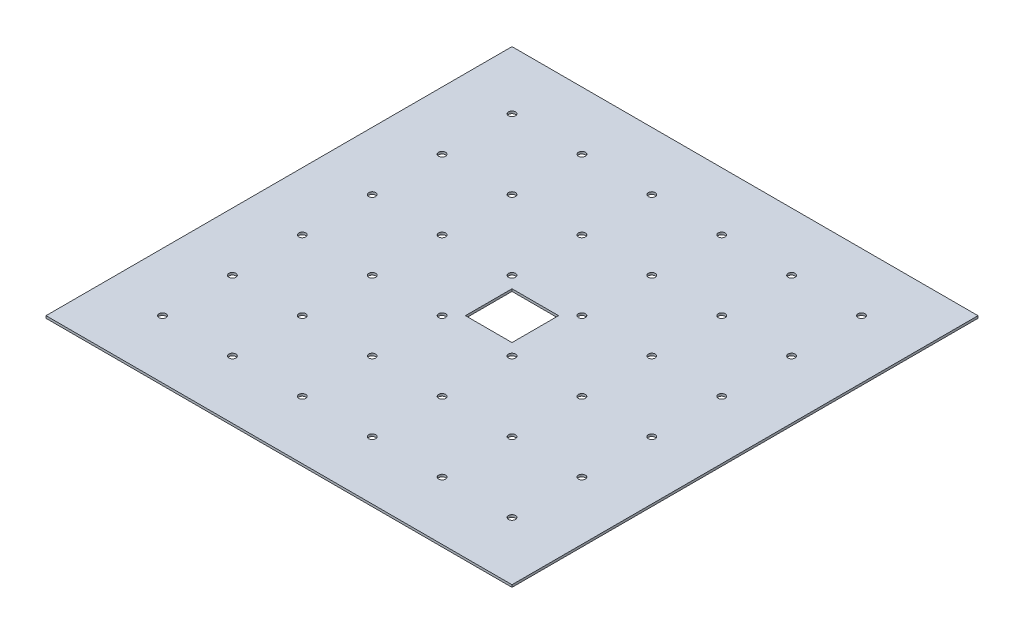
from build123d import *

# Parameters (mm, degrees)
SKETCH1_W           = 400
SKETCH1_H           = 400
BOSS_EXTRUDE1_DEPTH = 2
SKETCH2_R           = 3
CUT_EXTRUDE1_DEPTH  = 283.849783454
SKETCH3_W           = 40
SKETCH3_H           = 40
CUT_EXTRUDE2_DEPTH  = 283.849783454


with BuildPart() as part:
    # Sketch1 → Boss-Extrude1 (new body)
    with BuildSketch(Plane(origin=(0, 0, 0), x_dir=(1, 0, 0), z_dir=(0, 1, 0))):
        Rectangle(SKETCH1_W, SKETCH1_H)
    extrude(amount=BOSS_EXTRUDE1_DEPTH)

    # Sketch2 → Cut-Extrude1 (cut, through all)
    with BuildSketch(Plane(origin=(0, 2, 0), x_dir=(1, 0, 0), z_dir=(0, 1, 0))):
        with Locations(Location((-150, 150, 0), (0, 0, 270))):
            Circle(SKETCH2_R)
        with Locations(Location((-90, 150, 0), (0, 0, 270))):
            Circle(SKETCH2_R)
        with Locations(Location((-30, 150, 0), (0, 0, 270))):
            Circle(SKETCH2_R)
        with Locations(Location((30, 150, 0), (0, 0, 270))):
            Circle(SKETCH2_R)
        with Locations(Location((90, 150, 0), (0, 0, 270))):
            Circle(SKETCH2_R)
        with Locations(Location((150, 150, 0), (0, 0, 270))):
            Circle(SKETCH2_R)
        with Locations(Location((-90, 90, 0), (0, 0, 270))):
            Circle(SKETCH2_R)
        with Locations(Location((-30, 90, 0), (0, 0, 270))):
            Circle(SKETCH2_R)
        with Locations(Location((30, 90, 0), (0, 0, 270))):
            Circle(SKETCH2_R)
        with Locations(Location((90, 90, 0), (0, 0, 270))):
            Circle(SKETCH2_R)
        with Locations(Location((150, 90, 0), (0, 0, 270))):
            Circle(SKETCH2_R)
        with Locations(Location((-90, 30, 0), (0, 0, 270))):
            Circle(SKETCH2_R)
        with Locations(Location((-30, 30, 0), (0, 0, 270))):
            Circle(SKETCH2_R)
        with Locations(Location((30, 30, 0), (0, 0, 270))):
            Circle(SKETCH2_R)
        with Locations(Location((90, 30, 0), (0, 0, 270))):
            Circle(SKETCH2_R)
        with Locations(Location((150, 30, 0), (0, 0, 270))):
            Circle(SKETCH2_R)
        with Locations(Location((-90, -30, 0), (0, 0, 270))):
            Circle(SKETCH2_R)
        with Locations(Location((-30, -30, 0), (0, 0, 270))):
            Circle(SKETCH2_R)
        with Locations(Location((30, -30, 0), (0, 0, 270))):
            Circle(SKETCH2_R)
        with Locations(Location((90, -30, 0), (0, 0, 270))):
            Circle(SKETCH2_R)
        with Locations(Location((150, -30, 0), (0, 0, 270))):
            Circle(SKETCH2_R)
        with Locations(Location((-90, -90, 0), (0, 0, 270))):
            Circle(SKETCH2_R)
        with Locations(Location((-30, -90, 0), (0, 0, 270))):
            Circle(SKETCH2_R)
        with Locations(Location((30, -90, 0), (0, 0, 270))):
            Circle(SKETCH2_R)
        with Locations(Location((90, -90, 0), (0, 0, 270))):
            Circle(SKETCH2_R)
        with Locations(Location((150, -90, 0), (0, 0, 270))):
            Circle(SKETCH2_R)
        with Locations(Location((-90, -150, 0), (0, 0, 270))):
            Circle(SKETCH2_R)
        with Locations(Location((-30, -150, 0), (0, 0, 270))):
            Circle(SKETCH2_R)
        with Locations(Location((30, -150, 0), (0, 0, 270))):
            Circle(SKETCH2_R)
        with Locations(Location((90, -150, 0), (0, 0, 270))):
            Circle(SKETCH2_R)
        with Locations(Location((150, -150, 0), (0, 0, 270))):
            Circle(SKETCH2_R)
        with Locations(Location((-150, 90, 0), (0, 0, 270))):
            Circle(SKETCH2_R)
        with Locations(Location((-150, 30, 0), (0, 0, 270))):
            Circle(SKETCH2_R)
        with Locations(Location((-150, -30, 0), (0, 0, 270))):
            Circle(SKETCH2_R)
        with Locations(Location((-150, -90, 0), (0, 0, 270))):
            Circle(SKETCH2_R)
        with Locations(Location((-150, -150, 0), (0, 0, 270))):
            Circle(SKETCH2_R)
    extrude(amount=-CUT_EXTRUDE1_DEPTH, mode=Mode.SUBTRACT)

    # Sketch3 → Cut-Extrude2 (cut, through all)
    with BuildSketch(Plane(origin=(0, 2, 0), x_dir=(1, 0, 0), z_dir=(0, 1, 0))):
        Rectangle(SKETCH3_W, SKETCH3_H)
    extrude(amount=-CUT_EXTRUDE2_DEPTH, mode=Mode.SUBTRACT)


solid = part.part
